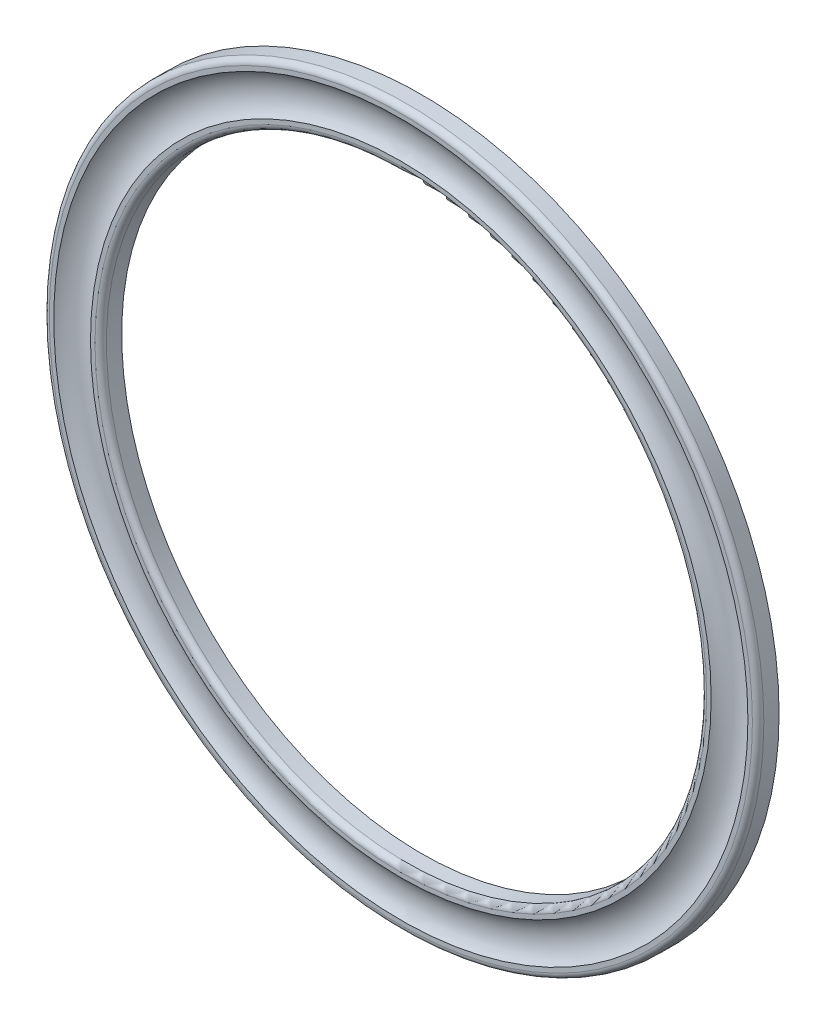
from build123d import *


with BuildPart() as part:
    # 草圖3 → 旋轉2 (revolve)
    with BuildSketch(Plane(origin=(0, 0, 0), x_dir=(1, 0, 0), z_dir=(0, 1, 0))):
        with BuildLine():
            Line((-10, 15), (10, 15))
            Line((10, 15), (10, 9.660444431))
            ThreePointArc((10, 9.660444431), (9.414213562, 8.246230869), (8, 7.660444431))
            Line((8, 7.660444431), (6.427876097, 7.660444431))
            ThreePointArc((6.427876097, 7.660444431), (0, 10), (-6.427876097, 7.660444431))
            Line((-6.427876097, 7.660444431), (-8, 7.660444431))
            ThreePointArc((-8, 7.660444431), (-9.414213562, 8.246230869), (-10, 9.660444431))
            Line((-10, 9.660444431), (-10, 15))
        make_face()
    revolve(axis=Axis((115, 0, 57.074015866), (0, 0, -1)))


solid = part.part
